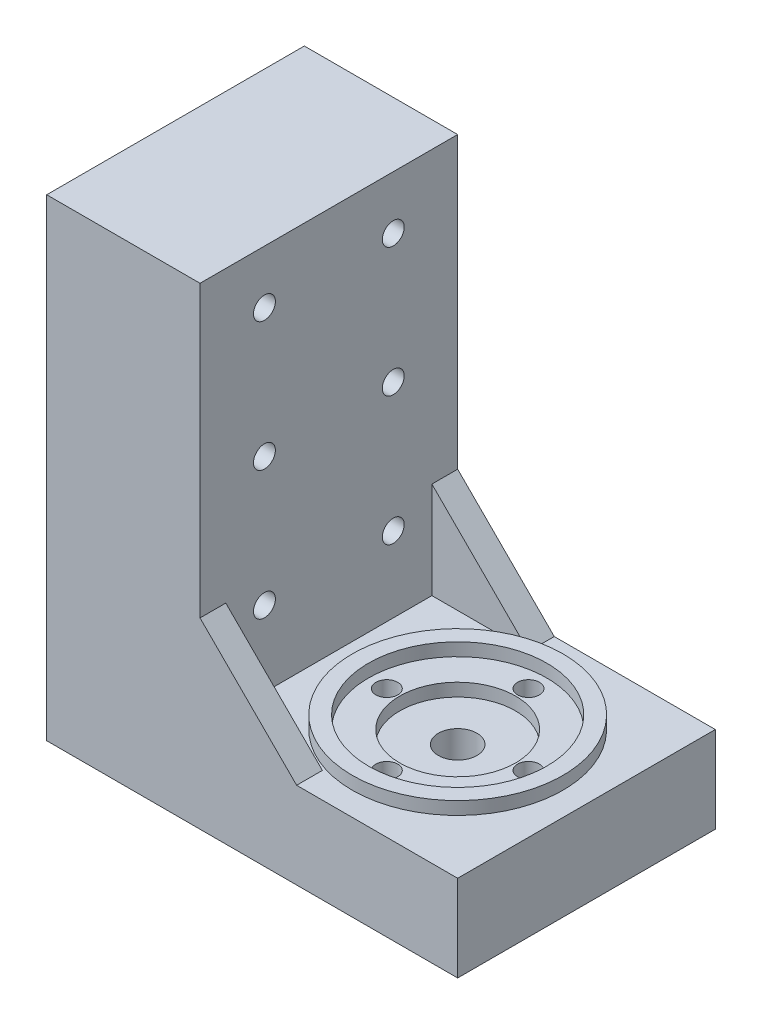
from build123d import *

# Parameters (mm, degrees)
SKETCH1_W           = 40
SKETCH1_H           = 40
BOSS_EXTRUDE1_DEPTH = 13.413545042
SKETCH2_R           = 3
CUT_EXTRUDE1_DEPTH  = 59.13710683
SKETCH3_W           = 40
SKETCH3_H           = 73.413545042
BOSS_EXTRUDE2_DEPTH = 23.804241557
SKETCH4_R           = 1.7
CUT_EXTRUDE2_DEPTH  = 93.679817629
SKETCH5_R           = 1.7
CUT_EXTRUDE3_DEPTH  = 83.462112512
SKETCH6_R           = 16.35
SKETCH6_R_2         = 13.85
BOSS_EXTRUDE3_DEPTH = 2
BOSS_EXTRUDE4_DEPTH = 4
BOSS_EXTRUDE5_DEPTH = 4
SKETCH9_R           = 9
CUT_EXTRUDE4_DEPTH  = 2


with BuildPart() as part:
    # Sketch1 → Boss-Extrude1 (new body)
    with BuildSketch(Plane(origin=(0, 0, 0), x_dir=(1, 0, 0), z_dir=(0, 1, 0))):
        with Locations((20, 20)):
            Rectangle(SKETCH1_W, SKETCH1_H)
    extrude(amount=BOSS_EXTRUDE1_DEPTH)

    # Sketch2 → Cut-Extrude1 (cut, through all)
    with BuildSketch(Plane(origin=(0, 13.413545042, 0), x_dir=(1, 0, 0), z_dir=(0, 1, 0))):
        with Locations(Location((20, 20, 0), (0, 0, 270))):
            Circle(SKETCH2_R)
    extrude(amount=-CUT_EXTRUDE1_DEPTH, mode=Mode.SUBTRACT)

    # Sketch3 → Boss-Extrude2 (add)
    with BuildSketch(Plane.ZY):
        with Locations((-20, 36.706772521)):
            Rectangle(SKETCH3_W, SKETCH3_H)
    extrude(amount=BOSS_EXTRUDE2_DEPTH)

    # Sketch4 → Cut-Extrude2 (cut, through all)
    with BuildSketch(Plane(origin=(0, 0, 0), x_dir=(0, 0, -1), z_dir=(1, 0, 0))):
        with Locations((10, 65.131260141)):
            Circle(SKETCH4_R)
        with Locations((30, 65.131260141)):
            Circle(SKETCH4_R)
        with Locations((10, 45.131260141)):
            Circle(SKETCH4_R)
        with Locations((30, 45.131260141)):
            Circle(SKETCH4_R)
        with Locations((10, 25.131260141)):
            Circle(SKETCH4_R)
        with Locations((30, 25.131260141)):
            Circle(SKETCH4_R)
    extrude(amount=-CUT_EXTRUDE2_DEPTH, mode=Mode.SUBTRACT)

    # Sketch5 → Cut-Extrude3 (cut, through all)
    with BuildSketch(Plane(origin=(0, 13.413545042, 0), x_dir=(1, 0, 0), z_dir=(0, 1, 0))):
        with Locations(Location((20, 31, 0), (0, 0, 270))):
            Circle(SKETCH5_R)
        with Locations(Location((31, 20, 0), (0, 0, 270))):
            Circle(SKETCH5_R)
        with Locations(Location((20, 9, 0), (0, 0, 270))):
            Circle(SKETCH5_R)
        with Locations(Location((9, 20, 0), (0, 0, 270))):
            Circle(SKETCH5_R)
    extrude(amount=-CUT_EXTRUDE3_DEPTH, mode=Mode.SUBTRACT)

    # Sketch6 → Boss-Extrude3 (add)
    with BuildSketch(Plane(origin=(0, 13.413545042, 0), x_dir=(1, 0, 0), z_dir=(0, 1, 0))):
        with Locations(Location((20, 20, 0), (0, 0, 90))):
            Circle(SKETCH6_R)
        with Locations(Location((20, 20, 0), (0, 0, 270))):
            Circle(SKETCH6_R_2, mode=Mode.SUBTRACT)
    extrude(amount=BOSS_EXTRUDE3_DEPTH)

    # Sketch7 → Boss-Extrude4 (add)
    with BuildSketch(Plane(origin=(0, 0, -40), x_dir=(-1, 0, 0), z_dir=(0, 0, -1))):
        Polygon((-15, 13.413545042), (0, 28.413545042), (0, 13.413545042), align=None)
    extrude(amount=-BOSS_EXTRUDE4_DEPTH)

    # Sketch8 → Boss-Extrude5 (add)
    with BuildSketch(Plane.XY):
        Polygon((0, 28.413545042), (0, 13.413545042), (15, 13.413545042), align=None)
    extrude(amount=-BOSS_EXTRUDE5_DEPTH)

    # Sketch9 → Cut-Extrude4 (cut)
    with BuildSketch(Plane(origin=(0, 13.413545042, 0), x_dir=(1, 0, 0), z_dir=(0, 1, 0))):
        with Locations(Location((20, 20, 0), (0, 0, 270))):
            Circle(SKETCH9_R)
    extrude(amount=-CUT_EXTRUDE4_DEPTH, mode=Mode.SUBTRACT)


solid = part.part
